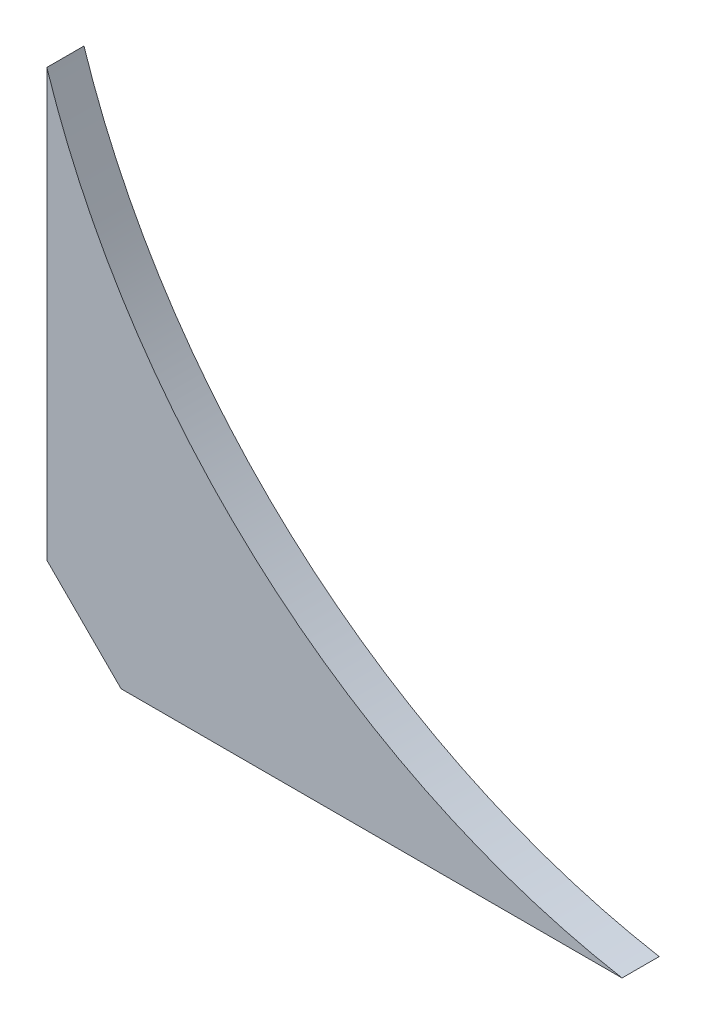
from build123d import *

# Parameters (mm, degrees)
BOSS_EXTRUDE1_DEPTH = 5


with BuildPart() as part:
    # Sketch1 → Boss-Extrude1 (new, symmetric)
    with BuildSketch(Plane.XY):
        with BuildLine():
            Line((-50.163247668, 92.91502482), (-50.163247668, -22.08497518))
            Line((-50.163247668, -22.08497518), (-30.163247668, -42.08497518))
            Line((-30.163247668, -42.08497518), (104.836752332, -42.08497518))
            ThreePointArc((104.836752332, -42.08497518), (8.666839753, 3.979199265), (-50.163247668, 92.91502482))
        make_face()
    extrude(amount=BOSS_EXTRUDE1_DEPTH, both=True)


solid = part.part
